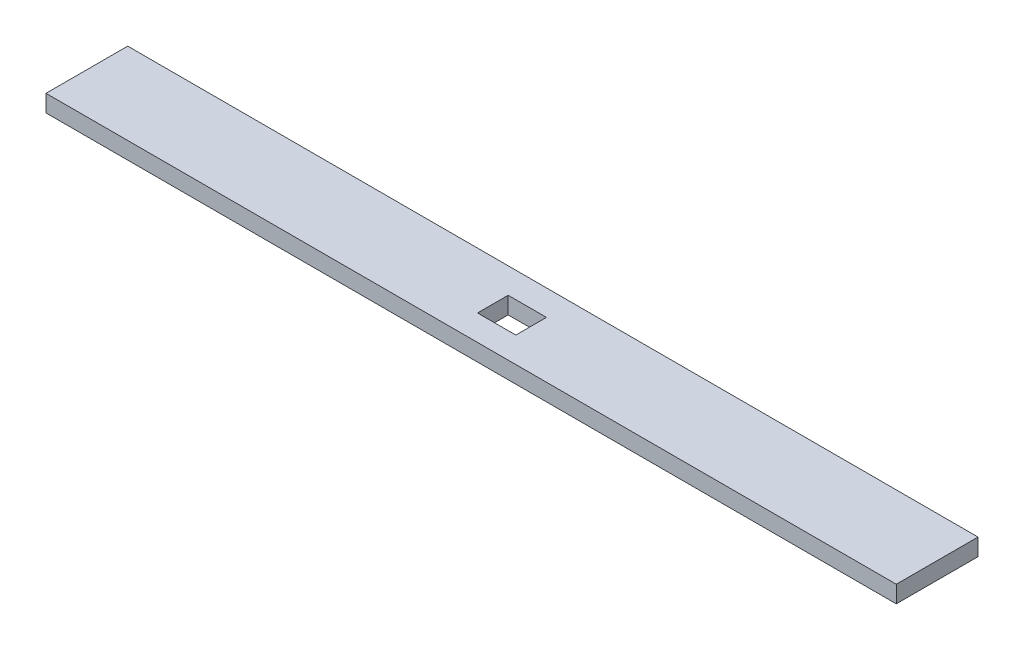
from build123d import *

# Parameters (mm, degrees)
SKETCH1_W           = 48
SKETCH1_H           = 10
BOSS_EXTRUDE1_DEPTH = 499.5
SKETCH2_W           = 22.5
SKETCH2_H           = 18
CUT_EXTRUDE1_DEPTH  = 502.900637577


with BuildPart() as part:
    # Sketch1 → Boss-Extrude1 (new body)
    with BuildSketch(Plane(origin=(0, 0, 0), x_dir=(0, 0, -1), z_dir=(1, 0, 0))):
        with Locations((24, 5)):
            Rectangle(SKETCH1_W, SKETCH1_H)
    extrude(amount=BOSS_EXTRUDE1_DEPTH)

    # Sketch2 → Cut-Extrude1 (cut, through all)
    with BuildSketch(Plane(origin=(0, 10, 0), x_dir=(1, 0, 0), z_dir=(0, 1, 0))):
        with Locations((249.75, 24)):
            Rectangle(SKETCH2_W, SKETCH2_H)
    extrude(amount=-CUT_EXTRUDE1_DEPTH, mode=Mode.SUBTRACT)


solid = part.part
